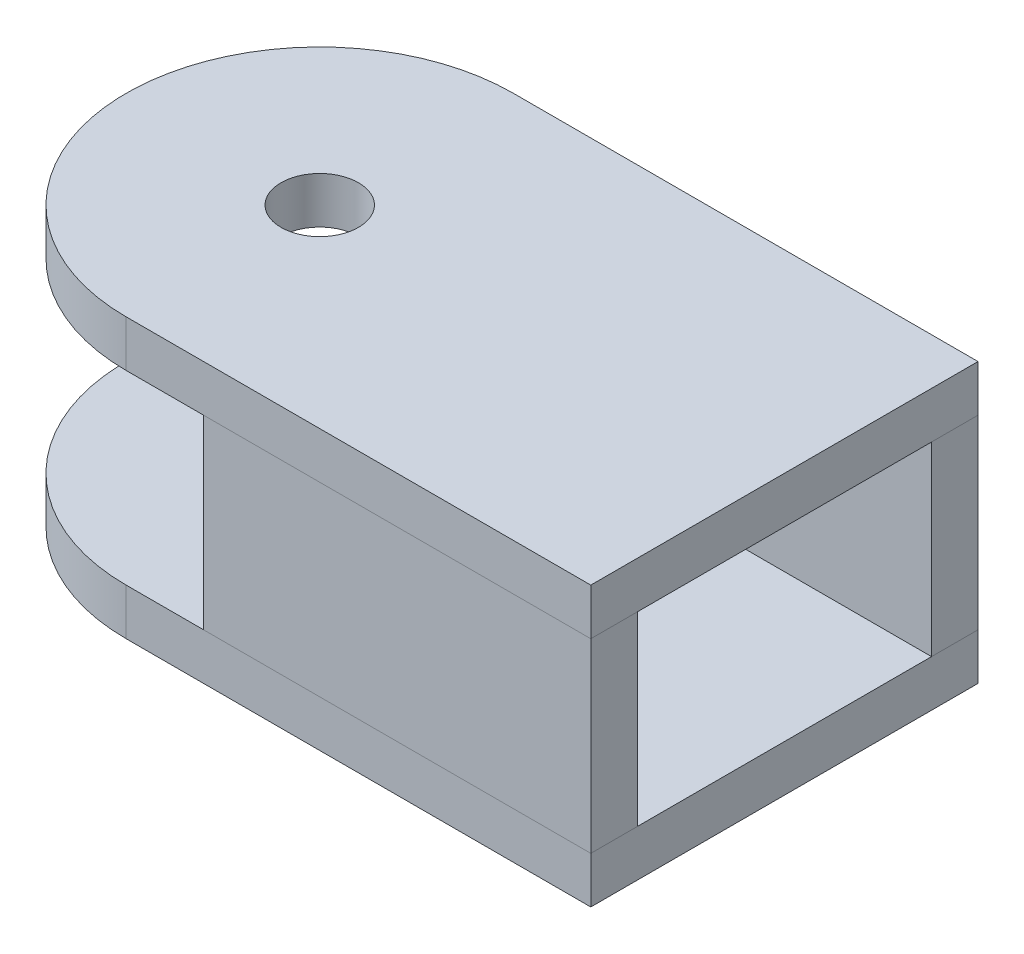
from build123d import *

# Parameters (mm, degrees)
SKETCH1_R               = 5
BOSS_EXTRUDE1_DEPTH     = 18
CUT_EXTRUDE1_DEPTH      = 64.03967005
CUT_EXTRUDE1_DEPTH_BACK = 64.03967005
SKETCH2_W               = 85
SKETCH2_H               = 24
BOSS_EXTRUDE2_REACH     = 69.454
SKETCH3_W               = 50
SKETCH3_H               = 6


with BuildPart() as part:
    # Sketch1 → Boss-Extrude1 (new, symmetric)
    with BuildSketch(Plane(origin=(0, 0, 0), x_dir=(1, 0, 0), z_dir=(0, 1, 0))):
        with BuildLine():
            Line((-30, -25), (30, -25))
            Line((30, -25), (30, 25))
            Line((30, 25), (-30, 25))
            ThreePointArc((-30, 25), (-55, 0), (-30, -25))
        make_face()
        with Locations(Location((-30, 0, 0), (0, 0, 270))):
            Circle(SKETCH1_R, mode=Mode.SUBTRACT)
    extrude(amount=BOSS_EXTRUDE1_DEPTH, both=True)

    # Sketch2 → Cut-Extrude1 (cut, two sides: drawn at the far end of the back side and taken through both)
    with BuildSketch(Plane.XY.offset(-CUT_EXTRUDE1_DEPTH_BACK)):
        with Locations((-12.5, 0)):
            Rectangle(SKETCH2_W, SKETCH2_H)
    extrude(amount=CUT_EXTRUDE1_DEPTH + CUT_EXTRUDE1_DEPTH_BACK, mode=Mode.SUBTRACT)


with BuildPart() as cut_extrude1_piece_1:
    # of the separate pieces the step leaves, piece 1, a body of its own (cut_extrude1_pieces)
    add(part.part.solids().sort_by_distance((-30, -12, 25))[0])


with BuildPart() as cut_extrude1_piece_2:
    # of the separate pieces the step leaves, piece 2, a body of its own (cut_extrude1_pieces)
    add(part.part.solids().sort_by_distance((-30, 18, 25))[0])


with BuildPart() as body_3:

    # Sketch3 → Boss-Extrude2 (new, up to next)
    with BuildSketch(Plane(origin=(0, -12, 0), x_dir=(1, 0, 0), z_dir=(0, 1, 0)), mode=Mode.PRIVATE) as boss_extrude2_sk1:
        with Locations((5, 22)):
            Rectangle(SKETCH3_W, SKETCH3_H)
    boss_extrude2_tool1 = extrude(boss_extrude2_sk1.sketch, amount=BOSS_EXTRUDE2_REACH, mode=Mode.PRIVATE) - cut_extrude1_piece_2.part
    # Sketch3 → Boss-Extrude2 (new, up to next)
    with BuildSketch(Plane(origin=(0, -12, 0), x_dir=(1, 0, 0), z_dir=(0, 1, 0)), mode=Mode.PRIVATE) as boss_extrude2_sk2:
        with Locations((5, -22)):
            Rectangle(SKETCH3_W, SKETCH3_H)
    boss_extrude2_tool2 = extrude(boss_extrude2_sk2.sketch, amount=BOSS_EXTRUDE2_REACH, mode=Mode.PRIVATE) - cut_extrude1_piece_2.part
    add(boss_extrude2_tool1.solids().sort_by_distance((5, -12, -22))[0])
    add(boss_extrude2_tool2.solids().sort_by_distance((5, -12, 22))[0])


solid = Compound([cut_extrude1_piece_1.part, cut_extrude1_piece_2.part, body_3.part])
